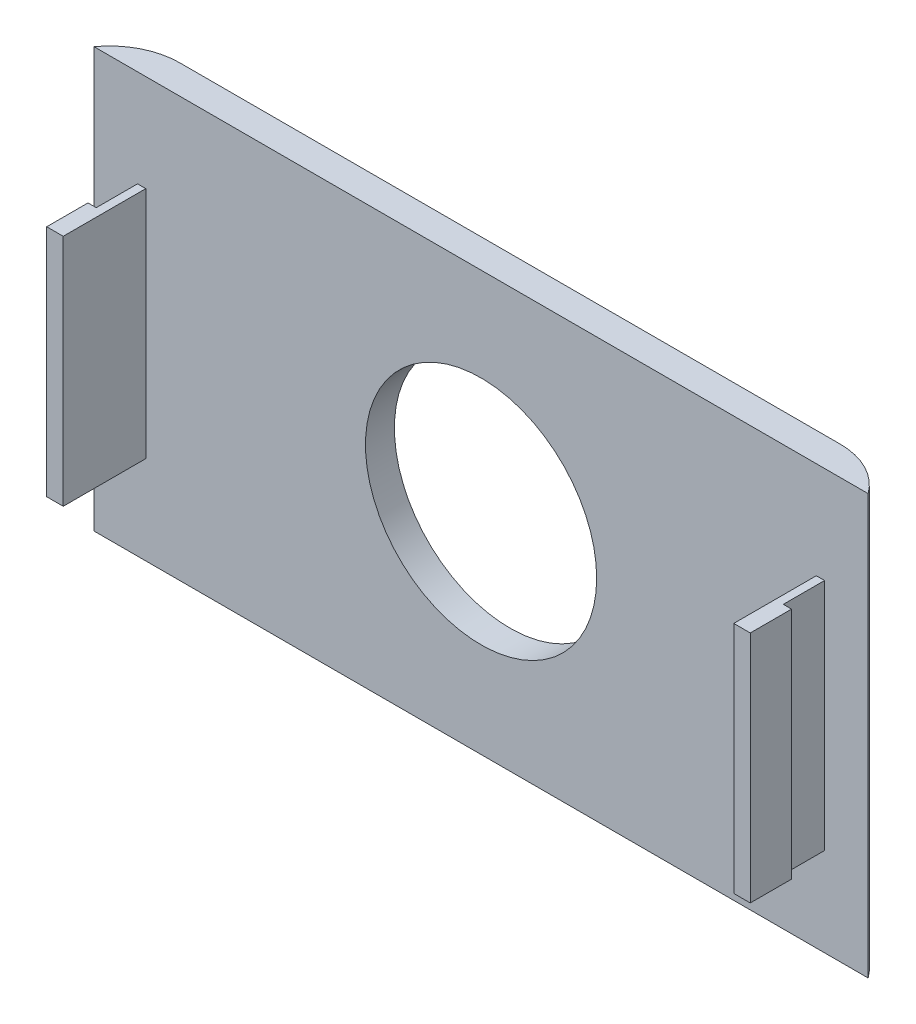
from build123d import *

# Parameters (mm, degrees)
BOSS_EXTRUDE1_DEPTH = 50.8
SKETCH4_W           = 2
SKETCH4_H           = 28.319341289
BOSS_EXTRUDE2_DEPTH = 10
SKETCH5_W           = 5
SKETCH5_H           = 28.319341289
CUT_EXTRUDE2_DEPTH  = 1
SKETCH8_R           = 14
CUT_EXTRUDE3_DEPTH  = 70.841706276


with BuildPart() as part:
    # Sketch1 → Boss-Extrude1 (new body)
    with BuildSketch(Plane(origin=(0, 0, 0), x_dir=(1, 0, 0), z_dir=(0, 1, 0))):
        with BuildLine():
            Line((-46.87455531, -10.750952702), (46.87455531, -10.750952702))
            ThreePointArc((46.87455531, -10.750952702), (43.857336275, -8.175639398), (40, -7.250001141))
            Line((40, -7.250001141), (-40, -7.250001141))
            ThreePointArc((-40, -7.250001141), (-43.857336275, -8.175639398), (-46.87455531, -10.750952702))
        make_face()
    extrude(amount=BOSS_EXTRUDE1_DEPTH)

    # Sketch4 → Boss-Extrude2 (add)
    with BuildSketch(Plane.XY.offset(10.750952702)):
        with Locations((41.6, 24.891155304)):
            Rectangle(SKETCH4_W, SKETCH4_H)
    boss_extrude2 = extrude(amount=BOSS_EXTRUDE2_DEPTH)

    # Sketch5 → Cut-Extrude2 (cut)
    with BuildSketch(Plane(origin=(42.6, 0, 0), x_dir=(0, 0, -1), z_dir=(1, 0, 0))):
        with Locations((-13.250952702, 24.891155304)):
            Rectangle(SKETCH5_W, SKETCH5_H)
    cut_extrude2 = extrude(amount=-CUT_EXTRUDE2_DEPTH, mode=Mode.SUBTRACT)

    # Mirror1: Boss-Extrude2, Cut-Extrude2 across plane
    add(boss_extrude2.mirror(Plane(origin=(0, 0, 0), x_dir=(0, 0, 1), z_dir=(1, 0, 0))))
    add(cut_extrude2.mirror(Plane(origin=(0, 0, 0), x_dir=(0, 0, 1), z_dir=(1, 0, 0))), mode=Mode.SUBTRACT)

    # Sketch8 → Cut-Extrude3 (cut, through all)
    with BuildSketch(Plane.XY.offset(10.750952702)):
        with Locations((0, 25.5)):
            Circle(SKETCH8_R)
    extrude(amount=-CUT_EXTRUDE3_DEPTH, mode=Mode.SUBTRACT)


solid = part.part
